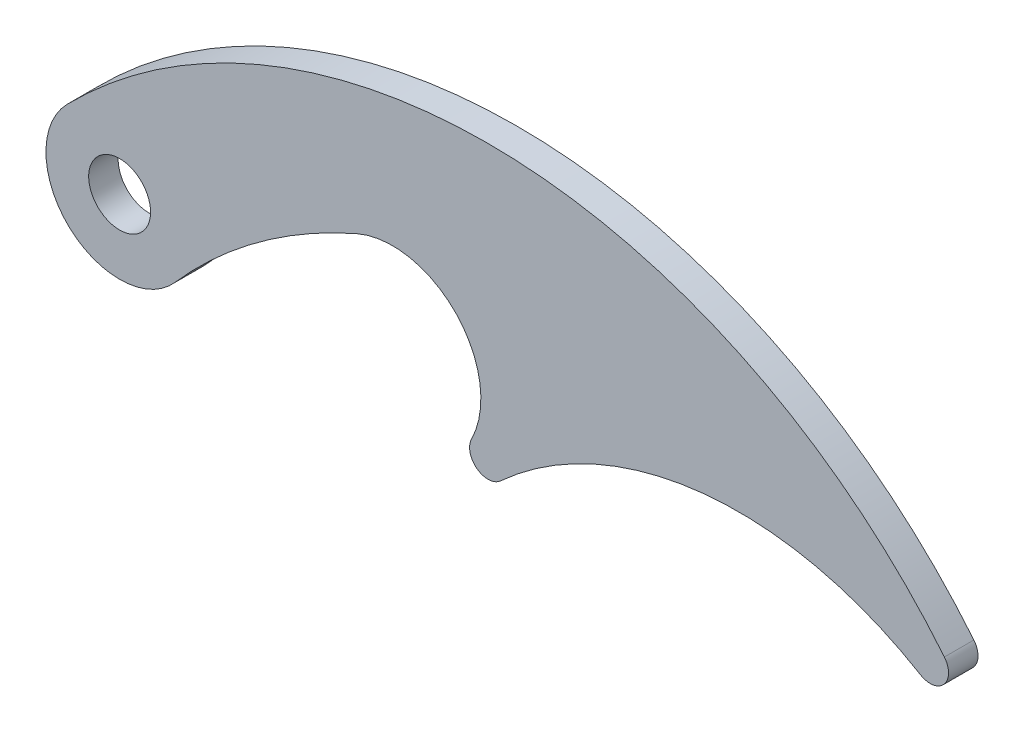
from build123d import *

# Parameters (mm, degrees)
SKETCH1_R           = 2.1
BOSS_EXTRUDE1_DEPTH = 2


with BuildPart() as part:
    # Sketch1 → Boss-Extrude1 (new body)
    with BuildSketch(Plane.XY):
        with BuildLine():
            ThreePointArc((23.881885124, -2.44114481), (24.246083691, -3.99705075), (25.842354675, -3.923546751))
            ThreePointArc((25.842354675, -3.923546751), (39.627475181, 2.225248194), (54.35720616, -1.072061603))
            ThreePointArc((54.35720616, -1.072061603), (55.945448574, -0.81769615), (55.968200147, 0.79062537))
            ThreePointArc((55.968200147, 0.79062537), (26.805089731, 15.449219208), (-3.569399351, 3.501340925))
            ThreePointArc((-3.569399351, 3.501340925), (-3.398562383, -3.667393315), (3.762428977, -3.293042391))
            ThreePointArc((3.762428977, -3.293042391), (9.440329247, 1.908120602), (16.118141008, 5.741849601))
            ThreePointArc((16.118141008, 5.741849601), (22.86761221, 4.371031998), (23.881885124, -2.44114481))
        make_face()
        Circle(SKETCH1_R, mode=Mode.SUBTRACT)
    extrude(amount=BOSS_EXTRUDE1_DEPTH)


solid = part.part
